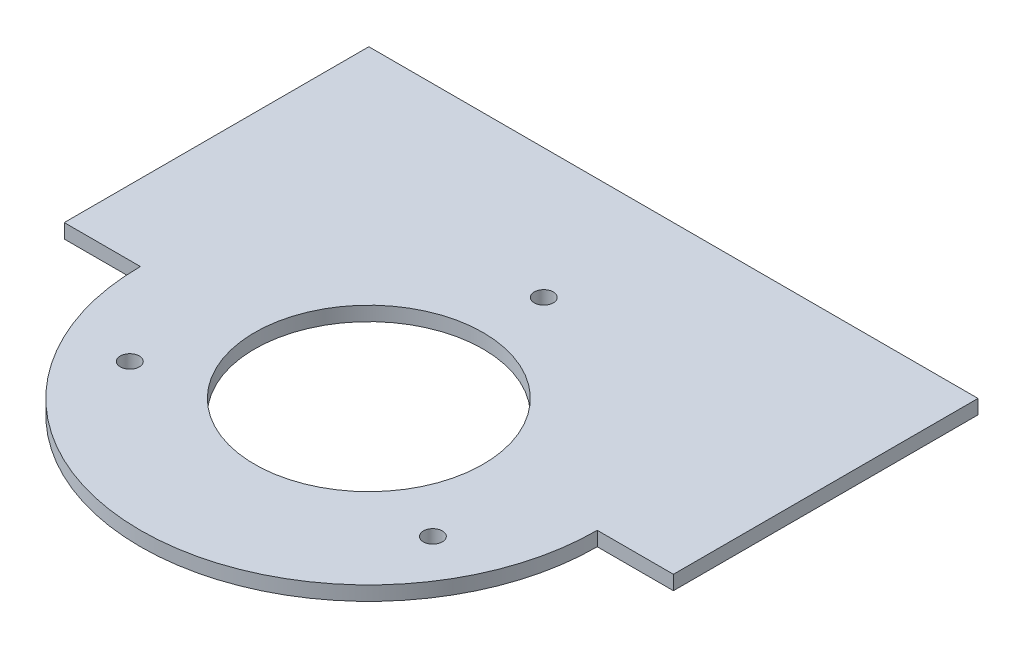
from build123d import *

# Parameters (mm, degrees)
SKETCH1_R           = 3.175
SKETCH1_R_2         = 38.1
BOSS_EXTRUDE1_DEPTH = 4.7625


with BuildPart() as part:
    # Sketch1 → Boss-Extrude1 (new body)
    with BuildSketch(Plane(origin=(0, 0, 0), x_dir=(1, 0, 0), z_dir=(0, 1, 0))):
        with BuildLine():
            Line((-101.6, 0), (-101.6, 101.6))
            Line((-101.6, 101.6), (101.6, 101.6))
            Line((101.6, 101.6), (101.6, 0))
            Line((101.6, 0), (76.2, 0))
            ThreePointArc((76.2, 0), (0, -76.2), (-76.2, 0))
            Line((-76.2, 0), (-101.6, 0))
        make_face()
        with Locations(Location((0, 58.365493413, 0), (0, 0, 90))):
            Circle(SKETCH1_R, mode=Mode.SUBTRACT)
        with Locations(Location((-50.546, -29.182746706, 0), (0, 0, 90))):
            Circle(SKETCH1_R, mode=Mode.SUBTRACT)
        with Locations(Location((50.546, -29.182746706, 0), (0, 0, 90))):
            Circle(SKETCH1_R, mode=Mode.SUBTRACT)
        with Locations(Location((0, 0, 0), (0, 0, 90))):
            Circle(SKETCH1_R_2, mode=Mode.SUBTRACT)
    extrude(amount=BOSS_EXTRUDE1_DEPTH)


solid = part.part
